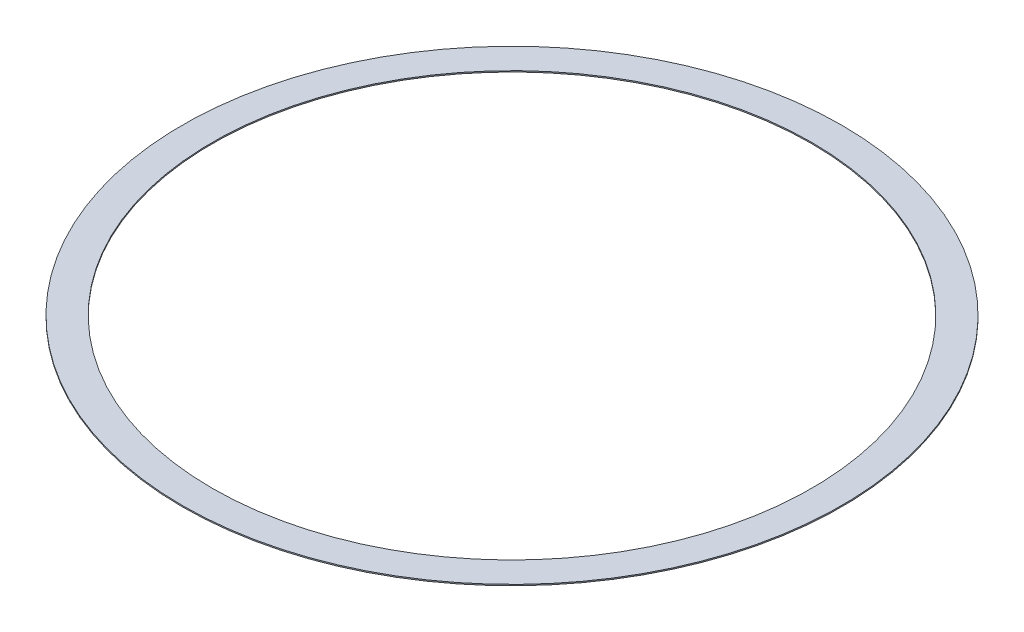
from build123d import *

# Parameters (mm, degrees)
SKETCH1_R           = 551.5
SKETCH1_R_2         = 501.5
BOSS_EXTRUDE1_DEPTH = 2


with BuildPart() as part:
    # Sketch1 → Boss-Extrude1 (new body)
    with BuildSketch(Plane(origin=(0, 0, 0), x_dir=(1, 0, 0), z_dir=(0, 1, 0))):
        with Locations(Location((0, 0, 0), (0, 0, 270))):
            Circle(SKETCH1_R)
        with Locations(Location((0, 0, 0), (0, 0, 270))):
            Circle(SKETCH1_R_2, mode=Mode.SUBTRACT)
    extrude(amount=BOSS_EXTRUDE1_DEPTH)


solid = part.part
